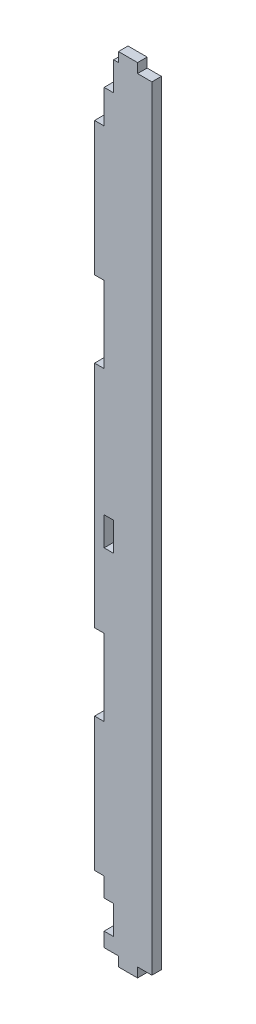
from build123d import *

# Parameters (mm, degrees)
SKETCH1_W           = 5
SKETCH1_H           = 15
BOSS_EXTRUDE1_DEPTH = 5


with BuildPart() as part:
    # Sketch1 → Boss-Extrude1 (new body)
    with BuildSketch(Plane.XY):
        Polygon((-440, -217.5), (-440, -177.5), (-445, -177.5), (-445, -107.5), (-440, -107.5), (-440, -90), (-435, -90), (-435, -75), (-432.5, -75), (-432.5, -70), (-422.5, -70), (-422.5, -75), (-415, -75), (-415, -480), (-422.5, -480), (-422.5, -485), (-432.5, -485), (-432.5, -480), (-440, -480), (-440, -472.5), (-435, -472.5), (-435, -457.5), (-440, -457.5), (-440, -447.5), (-445, -447.5), (-445, -377.5), (-440, -377.5), (-440, -337.5), (-445, -337.5), (-445, -217.5), align=None)
        with Locations((-437.5, -291.25)):
            Rectangle(SKETCH1_W, SKETCH1_H, mode=Mode.SUBTRACT)
    extrude(amount=BOSS_EXTRUDE1_DEPTH)


solid = part.part
